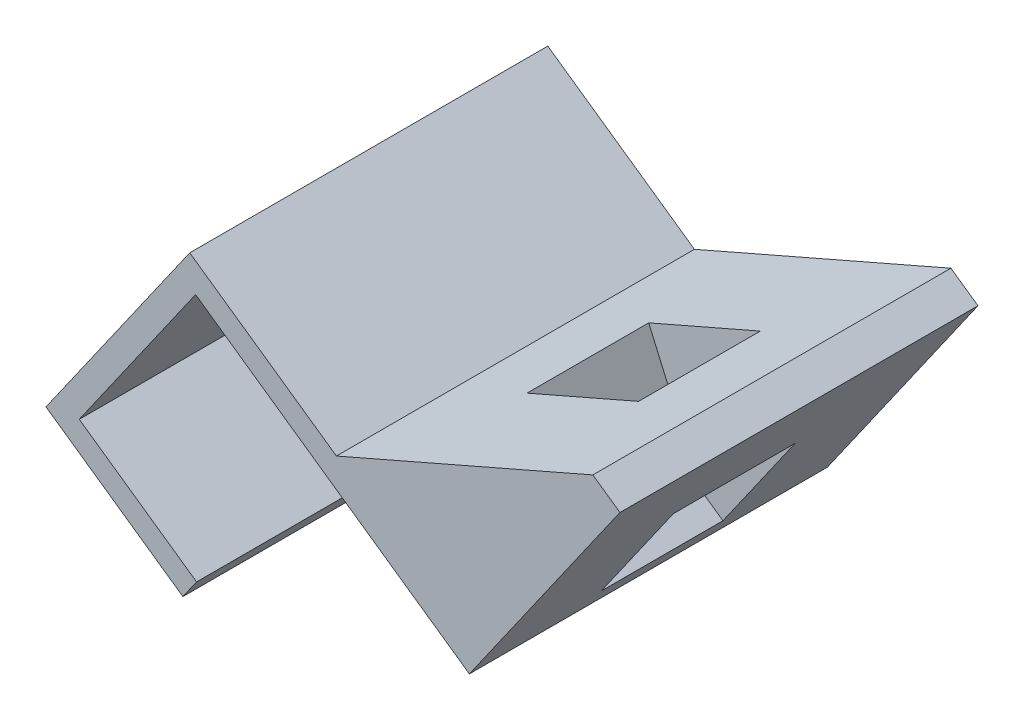
from build123d import *

# Parameters (mm, degrees)
EXTRUDE_THIN1_DEPTH              = 19.05
SKETCH8_W                        = 25.4
SKETCH8_H                        = 38.1
BOSS_EXTRUDE1_DEPTH              = 19.05
CUT_EXTRUDE3_DEPTH               = 87.66947312
CUT_EXTRUDE3_DEPTH_BACK          = 87.66947312
CUT_EXTRUDE4_REACH               = 76.686
CUT_EXTRUDE4_OFFSET_FROM_SURFACE = 2.54
SKETCH13_W                       = 12.954
SKETCH13_H                       = 12.954
CUT_EXTRUDE4_DIRECTION_2_DEPTH   = 73.146238944


with BuildPart() as part:
    # Sketch1 → Extrude-Thin1 (new, symmetric)
    with BuildSketch(Plane.XY):
        Polygon((-56.518566399, -10.196160483), (-71.084509945, 0), (-55.790269221, 21.84891532), (-24.57753305, 0), (-26.034127404, -2.080849078), (-55.166014498, 18.311471887), (-67.547066513, 0.624254723), (-55.061972044, -8.115311405), align=None)
    extrude(amount=EXTRUDE_THIN1_DEPTH, both=True)

    # Sketch8 → Boss-Extrude1 (add)
    with BuildSketch(Plane(origin=(-16.494988624, 11.546492037, 0), x_dir=(0.5734623443633238, 0.8192319205190437, 0), z_dir=(0.8192319205190437, -0.5734623443633238, 0))):
        with Locations((-1.394289721, 0)):
            Rectangle(SKETCH8_W, SKETCH8_H)
    extrude(amount=-BOSS_EXTRUDE1_DEPTH)

    # Sketch12 → Cut-Extrude3 (cut, two sides: drawn at the far end of the back side and taken through both)
    with BuildSketch(Plane(origin=(0, 0, -19.05), x_dir=(-1, 0, 0), z_dir=(0, 0, -1)).offset(-CUT_EXTRUDE3_DEPTH_BACK)):
        Polygon((40.183901135, 10.92445766), (12.895806765, 22.827442865), (25.617957589, 31.732948441), align=None)
    extrude(amount=CUT_EXTRUDE3_DEPTH + CUT_EXTRUDE3_DEPTH_BACK, mode=Mode.SUBTRACT)

    # Cut-Extrude4: up to this face of the body (flat: up to its plane, moved by the offset)
    cut_extrude4_end = Plane(part.part.faces().sort_by_distance((-40.600070951, 8.115311405, 0))[0]).offset(-CUT_EXTRUDE4_OFFSET_FROM_SURFACE)
    # Sketch13 → Cut-Extrude4 (cut, up to the picked face)
    with BuildSketch(Plane(origin=(-10.426997364, 23.904330147, 0), x_dir=(0.9165953540643084, 0.3998161538854141, 0), z_dir=(-0.3998161538854141, 0.9165953540643084, 0)), mode=Mode.PRIVATE) as cut_extrude4_sk1:
        with Locations((-17.579029301, 0)):
            Rectangle(SKETCH13_W, SKETCH13_H)
    cut_extrude4_tool1 = split(extrude(cut_extrude4_sk1.sketch, amount=-CUT_EXTRUDE4_REACH, mode=Mode.PRIVATE), bisect_by=cut_extrude4_end, keep=Keep.BOTH, mode=Mode.PRIVATE)
    add(cut_extrude4_tool1.solids().sort_by(Axis((-26.539854, 16.87595, 0), (0.3998161538854141, -0.9165953540643084, 0)))[0], mode=Mode.SUBTRACT)

    # Sketch13 → Cut-Extrude4 direction 2 (cut)
    with BuildSketch(Plane(origin=(-10.426997364, 23.904330147, 0), x_dir=(0.9165953540643084, 0.3998161538854141, 0), z_dir=(-0.3998161538854141, 0.9165953540643084, 0))):
        with Locations((-17.579029301, 0)):
            Rectangle(SKETCH13_W, SKETCH13_H)
    extrude(amount=CUT_EXTRUDE4_DIRECTION_2_DEPTH, mode=Mode.SUBTRACT)


solid = part.part
